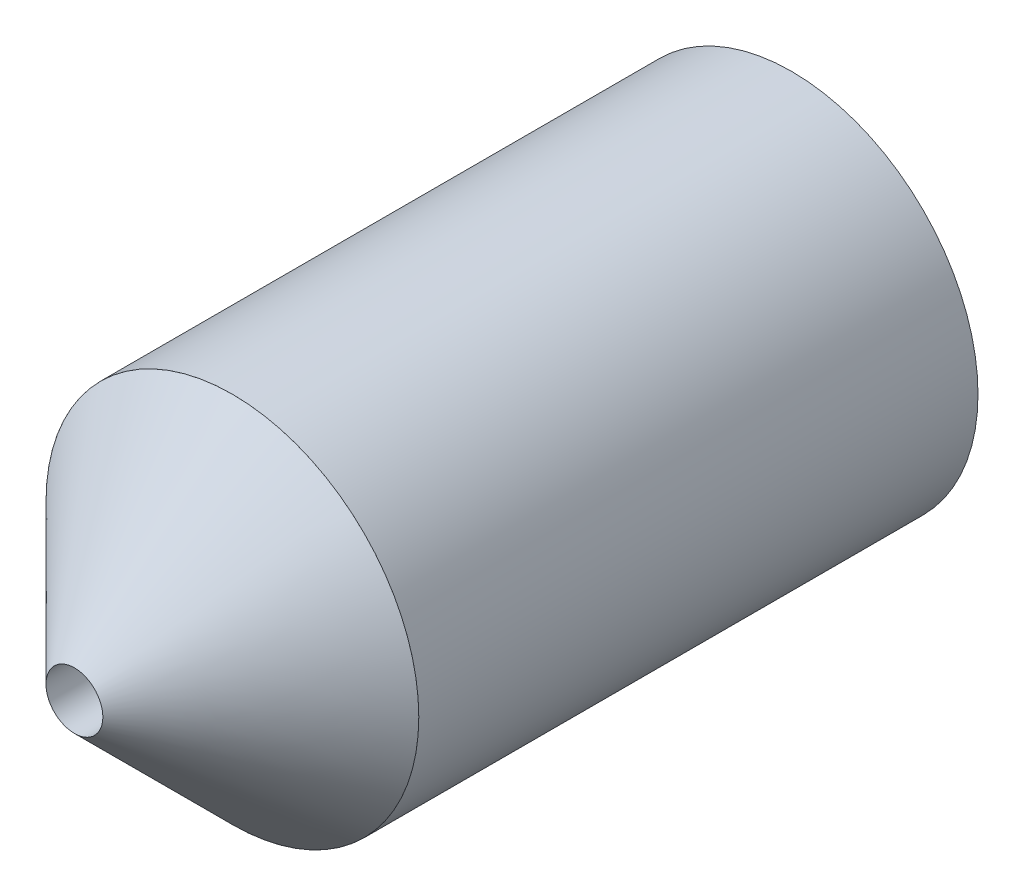
from build123d import *

# Parameters (mm, degrees)
SKETCH1_R           = 20
BOSS_EXTRUDE1_DEPTH = 60
SKETCH2_R           = 3.05
CUT_EXTRUDE1_DEPTH  = 30
SKETCH3_R           = 3.29
CUT_EXTRUDE2_DEPTH  = 30
CUT_EXTRUDE3_START  = -100
SKETCH7_R           = 3.05
CUT_EXTRUDE3_DEPTH  = 100


with BuildPart() as part:
    # Sketch1 → Boss-Extrude1 (new body)
    with BuildSketch(Plane.XY):
        Circle(SKETCH1_R)
    extrude(amount=BOSS_EXTRUDE1_DEPTH)

    # Sketch2 → Cut-Extrude1 (cut)
    with BuildSketch(Plane.XY.offset(60)):
        Circle(SKETCH2_R)
    extrude(amount=-CUT_EXTRUDE1_DEPTH, mode=Mode.SUBTRACT)

    # Sketch3 → Cut-Extrude2 (cut)
    with BuildSketch(Plane(origin=(0, 0, 0), x_dir=(-1, 0, 0), z_dir=(0, 0, -1))):
        Circle(SKETCH3_R)
    extrude(amount=-CUT_EXTRUDE2_DEPTH, mode=Mode.SUBTRACT)

    # Sketch6 → Revolve1 (revolve)
    with BuildSketch(Plane(origin=(0, 0, 0), x_dir=(0, 0, -1), z_dir=(1, 0, 0)), mode=Mode.PRIVATE) as revolve1_sk:
        Polygon((-60, 19.998024712), (-80, 0), (-60, 0), align=None)
    revolve(revolve1_sk.sketch.rotate(Axis((0, 0, 60), (0, 0, 1)), 90), axis=Axis((0, 0, 60), (0, 0, 1)))

    # Sketch7 → Cut-Extrude3 (cut)
    with BuildSketch(Plane(origin=(0, 0, 0), x_dir=(-1, 0, 0), z_dir=(0, 0, -1)).offset(CUT_EXTRUDE3_START)):
        with Locations(Location((0, 0, 0), (0, 0, 180))):
            Circle(SKETCH7_R)
    extrude(amount=CUT_EXTRUDE3_DEPTH, mode=Mode.SUBTRACT)


solid = part.part
